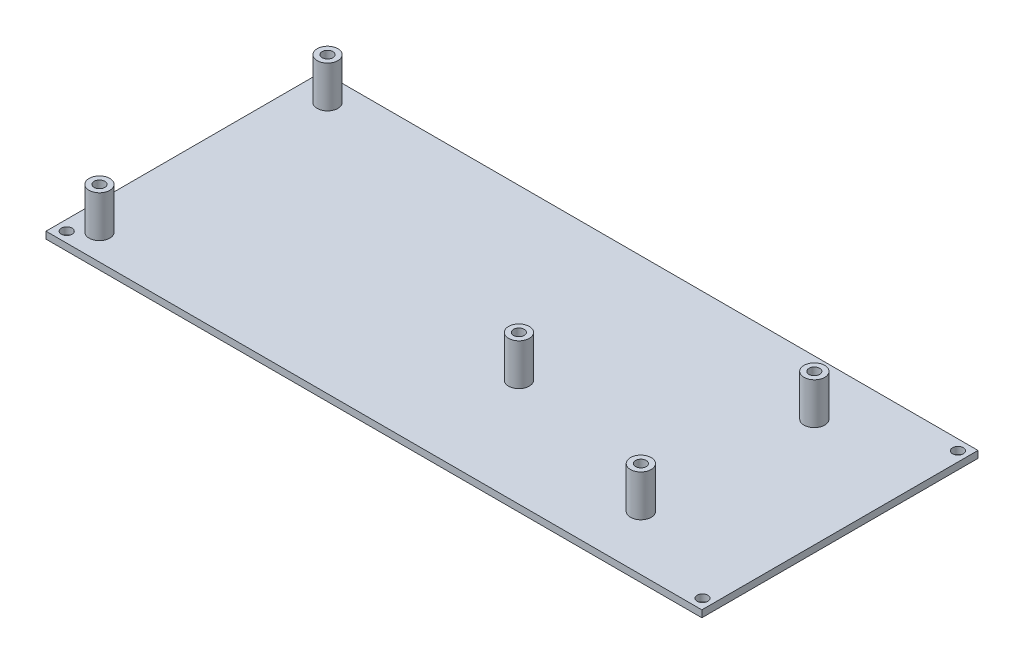
from build123d import *

# Parameters (mm, degrees)
SKETCH1_W           = 190
SKETCH1_H           = 80
SKETCH1_R           = 1.55
BOSS_EXTRUDE1_DEPTH = 2
SKETCH2_R           = 3
SKETCH2_R_2         = 1.55
BOSS_EXTRUDE2_DEPTH = 12


with BuildPart() as part:
    # Sketch1 → Boss-Extrude1 (new body)
    with BuildSketch(Plane(origin=(0, 0, 0), x_dir=(1, 0, 0), z_dir=(0, 1, 0))):
        with Locations((19.251207729, 0.579710145)):
            Rectangle(SKETCH1_W, SKETCH1_H)
        with Locations(Location((-72.748792271, 37.579710145, 0), (0, 0, 270))):
            Circle(SKETCH1_R, mode=Mode.SUBTRACT)
        with Locations(Location((111.435917928, 37.579710145, 0), (0, 0, 270))):
            Circle(SKETCH1_R, mode=Mode.SUBTRACT)
        with Locations(Location((111.435917928, -36.420289855, 0), (0, 0, 270))):
            Circle(SKETCH1_R, mode=Mode.SUBTRACT)
        with Locations(Location((-72.748792271, -36.420289855, 0), (0, 0, 270))):
            Circle(SKETCH1_R, mode=Mode.SUBTRACT)
    extrude(amount=BOSS_EXTRUDE1_DEPTH)

    # Sketch2 → Boss-Extrude2 (add)
    # profile 1 of 5: a face of its own
    with BuildSketch(Plane(origin=(0, 2, 0), x_dir=(1, 0, 0), z_dir=(0, 1, 0))):
        with Locations(Location((82.711207729, 24.709710145, 0), (0, 0, 270))):
            Circle(SKETCH2_R)
        with Locations(Location((82.711207729, 24.709710145, 0), (0, 0, 270))):
            Circle(SKETCH2_R_2, mode=Mode.SUBTRACT)
    # profile 2 of 5: a face of its own
    with BuildSketch(Plane(origin=(0, 2, 0), x_dir=(1, 0, 0), z_dir=(0, 1, 0))):
        with Locations(Location((80.711207729, -23.550289855, 0), (0, 0, 270))):
            Circle(SKETCH2_R)
        with Locations(Location((80.711207729, -23.550289855, 0), (0, 0, 270))):
            Circle(SKETCH2_R_2, mode=Mode.SUBTRACT)
    # profile 3 of 5: a face of its own
    with BuildSketch(Plane(origin=(0, 2, 0), x_dir=(1, 0, 0), z_dir=(0, 1, 0))):
        with Locations(Location((30.141207729, -8.310289855, 0), (0, 0, 270))):
            Circle(SKETCH2_R)
        with Locations(Location((30.141207729, -8.310289855, 0), (0, 0, 270))):
            Circle(SKETCH2_R_2, mode=Mode.SUBTRACT)
    # profile 4 of 5: a face of its own
    with BuildSketch(Plane(origin=(0, 2, 0), x_dir=(1, 0, 0), z_dir=(0, 1, 0))):
        with Locations(Location((-67.258792271, 33.649710145, 0), (0, 0, 270))):
            Circle(SKETCH2_R)
        with Locations(Location((-67.258792271, 33.649710145, 0), (0, 0, 270))):
            Circle(SKETCH2_R_2, mode=Mode.SUBTRACT)
    # profile 5 of 5: a face of its own
    with BuildSketch(Plane(origin=(0, 2, 0), x_dir=(1, 0, 0), z_dir=(0, 1, 0))):
        with Locations(Location((-67.748792271, -31.930289855, 0), (0, 0, 270))):
            Circle(SKETCH2_R)
        with Locations(Location((-67.748792271, -31.930289855, 0), (0, 0, 270))):
            Circle(SKETCH2_R_2, mode=Mode.SUBTRACT)
    extrude(amount=BOSS_EXTRUDE2_DEPTH)


solid = part.part
